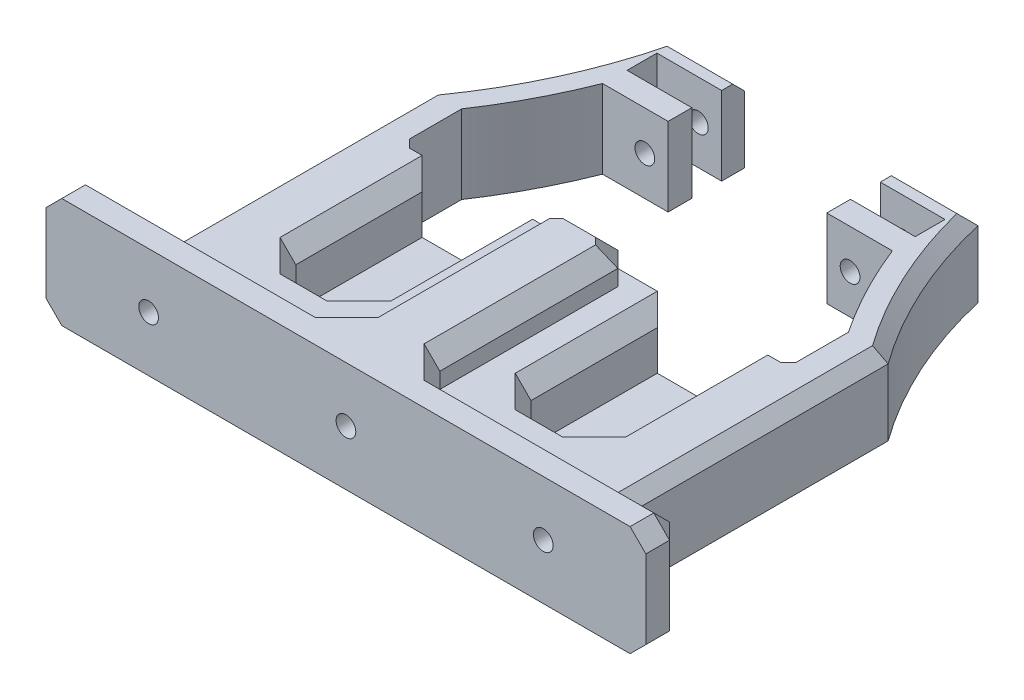
from build123d import *

# Parameters (mm, degrees)
BOSS_EXTRUDE1_DEPTH = 9.95
SKETCH2_W           = 58
SKETCH2_H           = 9.95
BOSS_EXTRUDE2_DEPTH = 8.55
SKETCH3_W           = 9.8
SKETCH3_H           = 11.55
BOSS_EXTRUDE3_DEPTH = 4
BOSS_EXTRUDE4_DEPTH = 20
CHAMFER1_SIZE       = 2
CUT_EXTRUDE1_REACH  = 70.57
CHAMFER2_SIZE       = 1
BOSS_EXTRUDE5_DEPTH = 5
CHAMFER3_SIZE       = 2
SKETCH7_W           = 10
SKETCH7_H           = 20
CUT_EXTRUDE2_DEPTH  = 7
CHAMFER4_SIZE       = 2
CHAMFER5_SIZE       = 1
SKETCH8_R           = 1.25
CUT_EXTRUDE3_DEPTH  = 15
CHAMFER6_SIZE       = 1.5
CHAMFER7_SIZE       = 2


with BuildPart() as part:
    # Sketch1 → Boss-Extrude1 (new body)
    with BuildSketch(Plane(origin=(0, 0, 0), x_dir=(1, 0, 0), z_dir=(0, 1, 0))):
        with BuildLine():
            Line((-10.05, -13), (-19.52904451, -13))
            ThreePointArc((-19.52904451, -13), (-23.22122875, -23.900809511), (-29, -33.853983643))
            Line((-29, -33.853983643), (-29, -45))
            Line((-29, -45), (29, -45))
            Line((29, -45), (29, -33.853983643))
            ThreePointArc((29, -33.853983643), (23.22122875, -23.900809511), (19.52904451, -13))
            Line((19.52904451, -13), (10.05, -13))
            Line((10.05, -13), (10.05, -15.9))
            Line((10.05, -15.9), (18.25, -15.9))
            Line((18.25, -15.9), (18.25, -19.68))
            Line((18.25, -19.68), (10.05, -19.68))
            Line((10.05, -19.68), (10.05, -22.68))
            Line((10.05, -22.68), (18.360244512, -22.68))
            ThreePointArc((18.360244512, -22.68), (21.116099011, -28.699201931), (24.5, -34.389082421))
            Line((24.5, -34.389082421), (24.5, -42))
            Line((24.5, -42), (-24.5, -42))
            Line((-24.5, -42), (-24.5, -34.389082421))
            ThreePointArc((-24.5, -34.389082421), (-21.116099011, -28.699201931), (-18.360244512, -22.68))
            Line((-18.360244512, -22.68), (-10.05, -22.68))
            Line((-10.05, -22.68), (-10.05, -19.68))
            Line((-10.05, -19.68), (-18.25, -19.68))
            Line((-18.25, -19.68), (-18.25, -15.9))
            Line((-18.25, -15.9), (-10.05, -15.9))
            Line((-10.05, -15.9), (-10.05, -13))
        make_face()
    extrude(amount=BOSS_EXTRUDE1_DEPTH)

    # Sketch2 → Boss-Extrude2 (add)
    with BuildSketch(Plane.XY.offset(45)):
        with Locations((0, 4.975)):
            Rectangle(SKETCH2_W, SKETCH2_H)
    extrude(amount=BOSS_EXTRUDE2_DEPTH)

    # Sketch3 → Boss-Extrude3 (add)
    with BuildSketch(Plane(origin=(0, 9.95, 0), x_dir=(1, 0, 0), z_dir=(0, 1, 0))):
        with Locations((0, -47.775)):
            Rectangle(SKETCH3_W, SKETCH3_H)
    extrude(amount=BOSS_EXTRUDE3_DEPTH)

    # Sketch4 → Boss-Extrude4 (add)
    with BuildSketch(Plane.XY.offset(53.55)):
        Polygon((-29, 9.95), (-29, 0), (29, 0), (29, 9.95), (4.9, 9.95), (4.9, 13.95), (-4.9, 13.95), (-4.9, 9.95), align=None)
    extrude(amount=BOSS_EXTRUDE4_DEPTH)

    # Chamfer1
    chamfer1_edges = [part.edges().sort_by_distance(p)[0] for p in [
        (4.9, 11.95, 42),
        (-4.9, 11.95, 42),
    ]]
    chamfer(chamfer1_edges, length=CHAMFER1_SIZE)

    # Cut-Extrude1: up to this face of the body (flat: up to its plane)
    cut_extrude1_end = Plane(part.part.faces().sort_by_distance((14.205122256, 4.975, 22.68))[0])
    # Sketch5 → Cut-Extrude1 (cut, up to the picked face)
    with BuildSketch(Plane(origin=(0, 0, 13), x_dir=(-1, 0, 0), z_dir=(0, 0, -1)), mode=Mode.PRIVATE) as cut_extrude1_sk1:
        with BuildLine():
            ThreePointArc((-14.25, 4.975), (-13, 3.725), (-11.75, 4.975))
            Line((-11.75, 4.975), (-14.25, 4.975))
        make_face()
    cut_extrude1_tool1 = split(extrude(cut_extrude1_sk1.sketch, amount=-CUT_EXTRUDE1_REACH, mode=Mode.PRIVATE), bisect_by=cut_extrude1_end, keep=Keep.BOTH, mode=Mode.PRIVATE)
    # Sketch5 → Cut-Extrude1 (cut, up to the picked face)
    with BuildSketch(Plane(origin=(0, 0, 13), x_dir=(-1, 0, 0), z_dir=(0, 0, -1)), mode=Mode.PRIVATE) as cut_extrude1_sk2:
        with BuildLine():
            Line((-14.25, 4.975), (-11.75, 4.975))
            ThreePointArc((-11.75, 4.975), (-13, 6.225), (-14.25, 4.975))
        make_face()
    cut_extrude1_tool2 = split(extrude(cut_extrude1_sk2.sketch, amount=-CUT_EXTRUDE1_REACH, mode=Mode.PRIVATE), bisect_by=cut_extrude1_end, keep=Keep.BOTH, mode=Mode.PRIVATE)
    # Sketch5 → Cut-Extrude1 (cut, up to the picked face)
    with BuildSketch(Plane(origin=(0, 0, 13), x_dir=(-1, 0, 0), z_dir=(0, 0, -1)), mode=Mode.PRIVATE) as cut_extrude1_sk3:
        with BuildLine():
            ThreePointArc((-14.25, 4.975), (-13, 3.725), (-11.75, 4.975))
            Line((-11.75, 4.975), (-14.25, 4.975))
        make_face()
    cut_extrude1_tool3 = split(extrude(cut_extrude1_sk3.sketch, amount=-CUT_EXTRUDE1_REACH, mode=Mode.PRIVATE), bisect_by=cut_extrude1_end, keep=Keep.BOTH, mode=Mode.PRIVATE)
    # Sketch5 → Cut-Extrude1 (cut, up to the picked face)
    with BuildSketch(Plane(origin=(0, 0, 13), x_dir=(-1, 0, 0), z_dir=(0, 0, -1)), mode=Mode.PRIVATE) as cut_extrude1_sk4:
        with BuildLine():
            Line((-14.25, 4.975), (-11.75, 4.975))
            ThreePointArc((-11.75, 4.975), (-13, 6.225), (-14.25, 4.975))
        make_face()
    cut_extrude1_tool4 = split(extrude(cut_extrude1_sk4.sketch, amount=-CUT_EXTRUDE1_REACH, mode=Mode.PRIVATE), bisect_by=cut_extrude1_end, keep=Keep.BOTH, mode=Mode.PRIVATE)
    # Sketch5 → Cut-Extrude1 (cut, up to the picked face)
    with BuildSketch(Plane(origin=(0, 0, 13), x_dir=(-1, 0, 0), z_dir=(0, 0, -1)), mode=Mode.PRIVATE) as cut_extrude1_sk5:
        with BuildLine():
            ThreePointArc((14.25, 4.975), (13, 6.225), (11.75, 4.975))
            Line((11.75, 4.975), (14.25, 4.975))
        make_face()
    cut_extrude1_tool5 = split(extrude(cut_extrude1_sk5.sketch, amount=-CUT_EXTRUDE1_REACH, mode=Mode.PRIVATE), bisect_by=cut_extrude1_end, keep=Keep.BOTH, mode=Mode.PRIVATE)
    # Sketch5 → Cut-Extrude1 (cut, up to the picked face)
    with BuildSketch(Plane(origin=(0, 0, 13), x_dir=(-1, 0, 0), z_dir=(0, 0, -1)), mode=Mode.PRIVATE) as cut_extrude1_sk6:
        with BuildLine():
            Line((14.25, 4.975), (11.75, 4.975))
            ThreePointArc((11.75, 4.975), (13, 3.725), (14.25, 4.975))
        make_face()
    cut_extrude1_tool6 = split(extrude(cut_extrude1_sk6.sketch, amount=-CUT_EXTRUDE1_REACH, mode=Mode.PRIVATE), bisect_by=cut_extrude1_end, keep=Keep.BOTH, mode=Mode.PRIVATE)
    # Sketch5 → Cut-Extrude1 (cut, up to the picked face)
    with BuildSketch(Plane(origin=(0, 0, 13), x_dir=(-1, 0, 0), z_dir=(0, 0, -1)), mode=Mode.PRIVATE) as cut_extrude1_sk7:
        with BuildLine():
            ThreePointArc((14.25, 4.975), (13, 6.225), (11.75, 4.975))
            Line((11.75, 4.975), (14.25, 4.975))
        make_face()
    cut_extrude1_tool7 = split(extrude(cut_extrude1_sk7.sketch, amount=-CUT_EXTRUDE1_REACH, mode=Mode.PRIVATE), bisect_by=cut_extrude1_end, keep=Keep.BOTH, mode=Mode.PRIVATE)
    # Sketch5 → Cut-Extrude1 (cut, up to the picked face)
    with BuildSketch(Plane(origin=(0, 0, 13), x_dir=(-1, 0, 0), z_dir=(0, 0, -1)), mode=Mode.PRIVATE) as cut_extrude1_sk8:
        with BuildLine():
            Line((14.25, 4.975), (11.75, 4.975))
            ThreePointArc((11.75, 4.975), (13, 3.725), (14.25, 4.975))
        make_face()
    cut_extrude1_tool8 = split(extrude(cut_extrude1_sk8.sketch, amount=-CUT_EXTRUDE1_REACH, mode=Mode.PRIVATE), bisect_by=cut_extrude1_end, keep=Keep.BOTH, mode=Mode.PRIVATE)
    add(cut_extrude1_tool1.solids().sort_by(Axis((13, 4.444484, 13), (0, 0, 1)))[0], mode=Mode.SUBTRACT)
    add(cut_extrude1_tool2.solids().sort_by(Axis((13, 5.505516, 13), (0, 0, 1)))[0], mode=Mode.SUBTRACT)
    add(cut_extrude1_tool3.solids().sort_by(Axis((13, 4.444484, 13), (0, 0, 1)))[0], mode=Mode.SUBTRACT)
    add(cut_extrude1_tool4.solids().sort_by(Axis((13, 5.505516, 13), (0, 0, 1)))[0], mode=Mode.SUBTRACT)
    add(cut_extrude1_tool5.solids().sort_by(Axis((-13, 5.505516, 13), (0, 0, 1)))[0], mode=Mode.SUBTRACT)
    add(cut_extrude1_tool6.solids().sort_by(Axis((-13, 4.444484, 13), (0, 0, 1)))[0], mode=Mode.SUBTRACT)
    add(cut_extrude1_tool7.solids().sort_by(Axis((-13, 5.505516, 13), (0, 0, 1)))[0], mode=Mode.SUBTRACT)
    add(cut_extrude1_tool8.solids().sort_by(Axis((-13, 4.444484, 13), (0, 0, 1)))[0], mode=Mode.SUBTRACT)

    # Chamfer2
    chamfer2_edges = [part.edges().sort_by_distance(p)[0] for p in [
        (11.75, 4.975, 13),
        (-11.75, 4.975, 13),
    ]]
    chamfer(chamfer2_edges, length=CHAMFER2_SIZE)

    # Sketch6 → Boss-Extrude5 (add)
    with BuildSketch(Plane.XY.offset(73.55)):
        Polygon((29, 9.95), (29, 0), (38, 0), (38, 13.95), (4.9, 13.95), (4.9, 9.95), align=None)
        Polygon((-38, 13.95), (-38, 0), (-29, 0), (-29, 9.95), (-4.9, 9.95), (-4.9, 13.95), align=None)
    extrude(amount=-BOSS_EXTRUDE5_DEPTH)

    # Chamfer3
    chamfer3_edges = [part.edges().sort_by_distance(p)[0] for p in [
        (0, 13.95, 42),
        (3.9, 13.95, 43),
        (-3.9, 13.95, 43),
        (4.9, 13.95, 56.275),
        (33.5, 0, 68.55),
        (38, 0, 71.05),
        (38, 6.975, 68.55),
        (38, 13.95, 71.05),
        (4.9, 11.95, 68.55),
        (21.45, 13.95, 68.55),
        (-4.9, 13.95, 56.275),
        (-38, 13.95, 71.05),
        (-33.5, 0, 68.55),
        (-38, 0, 71.05),
        (-21.45, 13.95, 68.55),
        (-4.9, 11.95, 68.55),
        (-38, 6.975, 68.55),
    ]]
    chamfer(chamfer3_edges, length=CHAMFER3_SIZE)

    # Sketch7 → Cut-Extrude2 (cut)
    with BuildSketch(Plane(origin=(0, 9.95, 0), x_dir=(1, 0, 0), z_dir=(0, 1, 0))):
        with Locations((-14.9, -52)):
            Rectangle(SKETCH7_W, SKETCH7_H)
        with Locations((14.9, -52)):
            Rectangle(SKETCH7_W, SKETCH7_H)
    extrude(amount=-CUT_EXTRUDE2_DEPTH, mode=Mode.SUBTRACT)

    # Chamfer4
    chamfer4_edges = [part.edges().sort_by_distance(p)[0] for p in [
        (-9.9, 9.95, 52),
        (-9.9, 6.45, 42),
        (-9.9, 6.45, 62),
        (-19.9, 6.45, 62),
        (-19.9, 6.45, 42),
        (-19.9, 9.95, 52),
        (-14.9, 9.95, 62),
        (19.9, 9.95, 52),
        (19.9, 6.45, 42),
        (19.9, 6.45, 62),
        (9.9, 6.45, 62),
        (9.9, 6.45, 42),
        (9.9, 9.95, 52),
        (14.9, 9.95, 62),
    ]]
    chamfer(chamfer4_edges, length=CHAMFER4_SIZE)

    # Chamfer5
    chamfer5_edges = [part.edges().sort_by_distance(p)[0] for p in [
        (-24.5, 4.975, 42),
        (24.5, 4.975, 42),
    ]]
    chamfer(chamfer5_edges, length=CHAMFER5_SIZE)

    # Sketch8 → Cut-Extrude3 (cut)
    with BuildSketch(Plane.XY.offset(73.55)):
        with Locations((-25, 6.975)):
            Circle(SKETCH8_R)
        with Locations((25, 6.975)):
            Circle(SKETCH8_R)
        with Locations((0, 6.975)):
            Circle(SKETCH8_R)
    extrude(amount=-CUT_EXTRUDE3_DEPTH, mode=Mode.SUBTRACT)

    # Chamfer6
    chamfer6_edges = [part.edges().sort_by_distance(p)[0] for p in [
        (-29, 9.95, 51.201991821),
        (-14.789522255, 9.95, 13),
        (-23.22122875, 9.95, 23.900809511),
        (29, 9.95, 51.201991821),
        (23.22122875, 9.95, 23.900809511),
        (14.789522255, 9.95, 13),
    ]]
    chamfer(chamfer6_edges, length=CHAMFER6_SIZE)

    # Chamfer7
    chamfer7_edges = [part.edges().sort_by_distance(p)[0] for p in [
        (-14.9, 2.95, 42),
        (14.9, 2.95, 42),
    ]]
    chamfer(chamfer7_edges, length=CHAMFER7_SIZE)


solid = part.part
